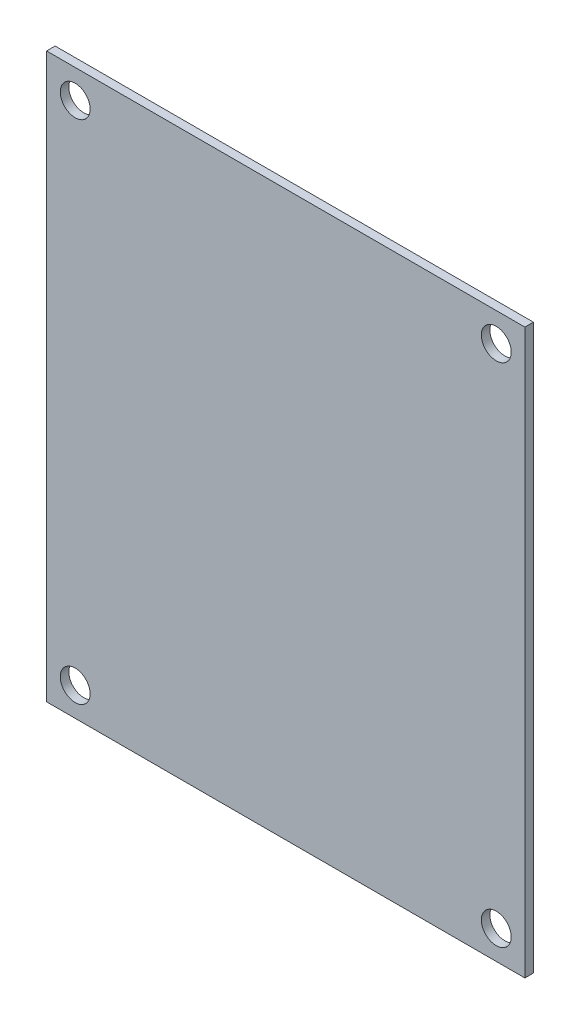
from build123d import *

# Parameters (mm, degrees)
SKETCH1_W           = 56
SKETCH1_H           = 66
SKETCH1_R           = 1.75
BOSS_EXTRUDE1_DEPTH = 1


with BuildPart() as part:
    # Sketch1 → Boss-Extrude1 (new body)
    with BuildSketch(Plane.XY):
        Rectangle(SKETCH1_W, SKETCH1_H)
        with Locations((-24.65, 29.65)):
            Circle(SKETCH1_R, mode=Mode.SUBTRACT)
        with Locations((24.65, 29.65)):
            Circle(SKETCH1_R, mode=Mode.SUBTRACT)
        with Locations((24.65, -29.65)):
            Circle(SKETCH1_R, mode=Mode.SUBTRACT)
        with Locations((-24.65, -29.65)):
            Circle(SKETCH1_R, mode=Mode.SUBTRACT)
    extrude(amount=BOSS_EXTRUDE1_DEPTH)


solid = part.part
